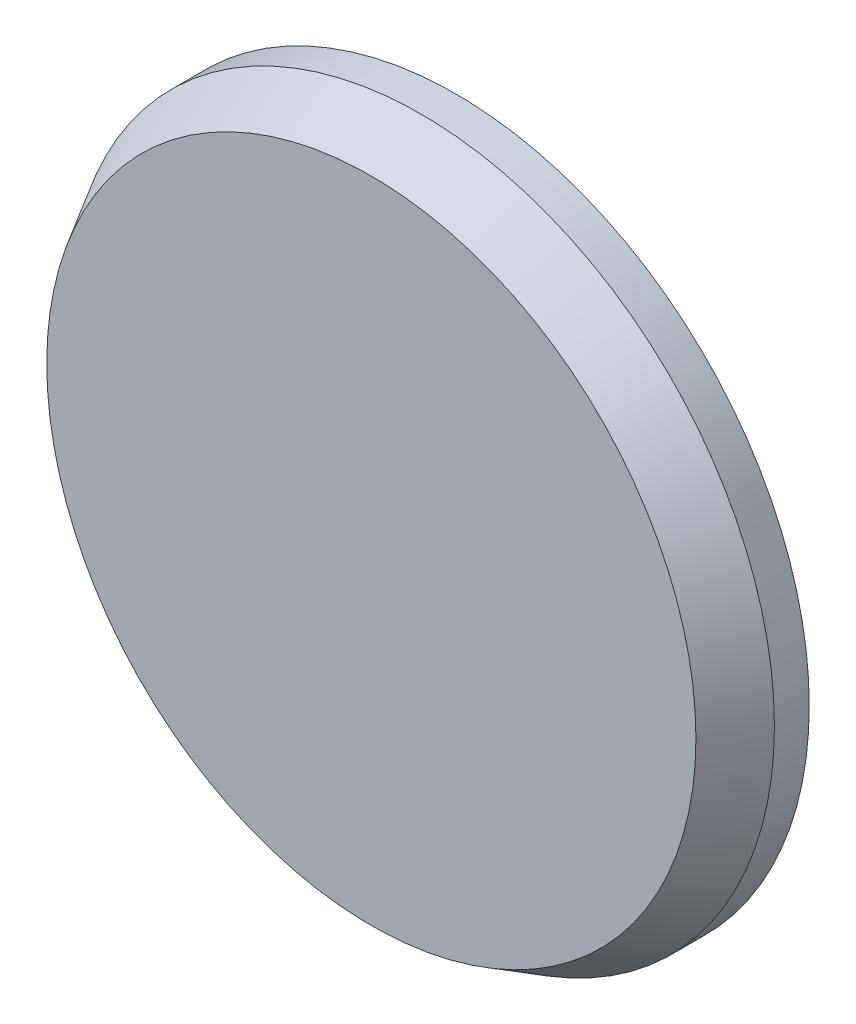
from build123d import *

# Parameters (mm, degrees)
SKETCH1_R           = 17.75
BOSS_EXTRUDE1_DEPTH = 4.25
CUT_EXTRUDE1_DEPTH  = 2.75
CHAMFER1_SIZE       = 2.5
CHAMFER1_SIZE2      = 1.443375673


with BuildPart() as part:
    # Sketch1 → Boss-Extrude1 (new body)
    with BuildSketch(Plane.XY):
        Circle(SKETCH1_R)
    extrude(amount=BOSS_EXTRUDE1_DEPTH)

    # Sketch2 → Cut-Extrude1 (cut)
    with BuildSketch(Plane(origin=(0, 0, 0), x_dir=(-1, 0, 0), z_dir=(0, 0, -1))):
        Polygon((-14.504482066, -1.15), (-14.504482066, 1.15), (-1.15, 1.15), (-1.15, 14.504482066), (1.15, 14.504482066), (1.15, 1.15), (14.504482066, 1.15), (14.504482066, -1.15), (1.15, -1.15), (1.15, -14.504482066), (-1.15, -14.504482066), (-1.15, -1.15), align=None)
    extrude(amount=-CUT_EXTRUDE1_DEPTH, mode=Mode.SUBTRACT)

    # Chamfer1
    chamfer1_edges = [part.edges().sort_by_distance(p)[0] for p in [
        (-17.75, 0, 4.25),
    ]]
    chamfer1_side = [part.faces().sort_by_distance(p)[0] for p in [
        (-17.75, 0, 2.125),
    ]]
    chamfer(chamfer1_edges, length=CHAMFER1_SIZE, length2=CHAMFER1_SIZE2, reference=chamfer1_side[0])


solid = part.part
